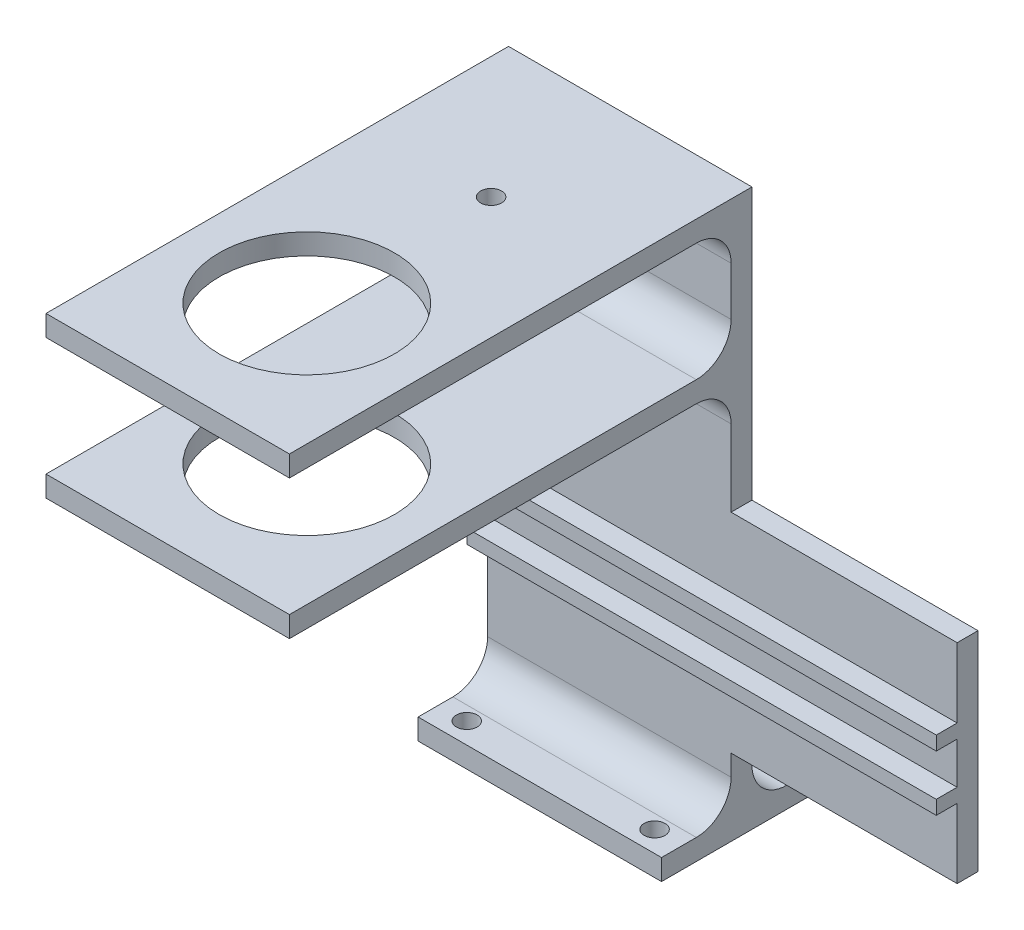
from build123d import *

# Parameters (mm, degrees)
SKETCH1_W                = 35
SKETCH1_H                = 40
BOSS_EXTRUDE1_DEPTH      = 3
SKETCH2_R                = 12.6
CUT_EXTRUDE1_DEPTH       = 27.744158241
SKETCH4_W                = 35
SKETCH4_H                = 3
BOSS_EXTRUDE2_DEPTH      = 23.5
SKETCH5_W                = 35
SKETCH5_H                = 80
BOSS_EXTRUDE3_DEPTH      = 3
SKETCH6_W                = 35
SKETCH6_H                = 63.5
SKETCH6_R                = 12.6
BOSS_EXTRUDE4_DEPTH      = 3
BOSS_EXTRUDE5_DEPTH      = 10
BOSS_EXTRUDE5_DEPTH_BACK = 13
SKETCH7_W                = 35
SKETCH7_H                = 3
FILLET1_R                = 5
SKETCH8_W                = 100
SKETCH8_H                = 30
BOSS_EXTRUDE6_DEPTH      = 3
SKETCH10_W               = 100
SKETCH10_H               = 2
BOSS_EXTRUDE8_DEPTH      = 3
SKETCH12_R               = 1.5
CUT_EXTRUDE3_DEPTH       = 108.801901653
MIRROR2_COPY_1_SKETCH_R  = 1.5
MIRROR2_COPY_1_DEPTH     = 108.801901653
CUT_EXTRUDE4_DEPTH       = 32.5
SKETCH26_R               = 1.5
CUT_EXTRUDE17_DEPTH      = 10


with BuildPart() as part:
    # Sketch1 → Boss-Extrude1 (new body)
    with BuildSketch(Plane(origin=(0, 0, 0), x_dir=(1, 0, 0), z_dir=(0, 1, 0))):
        Rectangle(SKETCH1_W, SKETCH1_H)
    extrude(amount=BOSS_EXTRUDE1_DEPTH)

    # Sketch2 → Cut-Extrude1 (cut, through all)
    with BuildSketch(Plane(origin=(0, 3, 0), x_dir=(1, 0, 0), z_dir=(0, 1, 0))):
        with Locations(Location((0, 0, 0), (0, 0, 270))):
            Circle(SKETCH2_R)
    extrude(amount=-CUT_EXTRUDE1_DEPTH, mode=Mode.SUBTRACT)

    # Sketch4 → Boss-Extrude2 (add)
    with BuildSketch(Plane(origin=(0, 0, -20), x_dir=(-1, 0, 0), z_dir=(0, 0, -1))):
        with Locations((0, 1.5)):
            Rectangle(SKETCH4_W, SKETCH4_H)
    extrude(amount=BOSS_EXTRUDE2_DEPTH)

    # Sketch5 → Boss-Extrude3 (add)
    with BuildSketch(Plane(origin=(0, 0, -43.5), x_dir=(-1, 0, 0), z_dir=(0, 0, -1))):
        with Locations((0, -37)):
            Rectangle(SKETCH5_W, SKETCH5_H)
    extrude(amount=BOSS_EXTRUDE3_DEPTH)

    # Sketch6 → Boss-Extrude4 (add)
    with BuildSketch(Plane(origin=(0, -17, 0), x_dir=(1, 0, 0), z_dir=(0, 1, 0))):
        with Locations((0, 11.75)):
            Rectangle(SKETCH6_W, SKETCH6_H)
        with Locations(Location((0, 0, 0), (0, 0, 270))):
            Circle(SKETCH6_R, mode=Mode.SUBTRACT)
    extrude(amount=-BOSS_EXTRUDE4_DEPTH)

    # Sketch7 → Boss-Extrude5 (add, two sides: drawn at the far end of the back side and taken through both)
    with BuildSketch(Plane.XY.offset(-43.5).offset(-BOSS_EXTRUDE5_DEPTH_BACK)):
        with Locations((0, -75.5)):
            Rectangle(SKETCH7_W, SKETCH7_H)
    extrude(amount=BOSS_EXTRUDE5_DEPTH + BOSS_EXTRUDE5_DEPTH_BACK)

    # Fillet1
    fillet1_edges = [part.edges().sort_by_distance(p)[0] for p in [
        (0, 0, -43.5),
        (0, -20, -43.5),
        (0, -17, -43.5),
        (0, -74, -46.5),
        (0, -74, -43.5),
    ]]
    fillet(fillet1_edges, radius=FILLET1_R)

    # Sketch8 → Boss-Extrude6 (add)
    with BuildSketch(Plane.XY.offset(-43.5)):
        with Locations((0, -51)):
            Rectangle(SKETCH8_W, SKETCH8_H)
    extrude(amount=-BOSS_EXTRUDE6_DEPTH)

    # Sketch10 → Boss-Extrude8 (add)
    with BuildSketch(Plane.XY.offset(-43.5)):
        with Locations((0, -47)):
            Rectangle(SKETCH10_W, SKETCH10_H)
        with Locations((0, -55)):
            Rectangle(SKETCH10_W, SKETCH10_H)
    extrude(amount=BOSS_EXTRUDE8_DEPTH)

    # Sketch12 → Cut-Extrude3 (cut, through all)
    with BuildSketch(Plane(origin=(0, -74, 0), x_dir=(1, 0, 0), z_dir=(0, 1, 0))):
        with Locations(Location((-13.5, 36.5, 0), (0, 0, 270))):
            Circle(SKETCH12_R)
    cut_extrude3 = extrude(amount=-CUT_EXTRUDE3_DEPTH, mode=Mode.SUBTRACT)

    # Mirror1: Cut-Extrude3 across plane
    add(cut_extrude3.mirror(Plane.ZY), mode=Mode.SUBTRACT)

    # Mirror2: Cut-Extrude3 across plane
    add(cut_extrude3.mirror(Plane(origin=(0, 0, -45), x_dir=(1, 0, 0), z_dir=(0, 0, -1))), mode=Mode.SUBTRACT)

    # Mirror2 copy 1 sketch → Mirror2 copy 1 (cut, through all)
    with BuildSketch(Plane(origin=(0, -74, -90), x_dir=(-1, 0, 0), z_dir=(0, 1, 0))):
        with Locations(Location((-13.5, 36.5, 0), (0, 0, 270))):
            Circle(MIRROR2_COPY_1_SKETCH_R)
    extrude(amount=-MIRROR2_COPY_1_DEPTH, mode=Mode.SUBTRACT)

    # Sketch13 → Cut-Extrude4 (cut)
    with BuildSketch(Plane.ZY.offset(50)):
        Polygon((-43.5, -36), (-46.5, -36), (-46.5, -66), (-43.5, -66), (-43.5, -56), (-40.5, -56), (-40.5, -54), (-43.5, -54), (-43.5, -48), (-40.5, -48), (-40.5, -46), (-43.5, -46), align=None)
    extrude(amount=-CUT_EXTRUDE4_DEPTH, mode=Mode.SUBTRACT)

    # Sketch26 → Cut-Extrude17 (cut)
    with BuildSketch(Plane(origin=(0, 3, 0), x_dir=(1, 0, 0), z_dir=(0, 1, 0))):
        with Locations(Location((0, 26.5, 0), (0, 0, 270))):
            Circle(SKETCH26_R)
    extrude(amount=-CUT_EXTRUDE17_DEPTH, mode=Mode.SUBTRACT)


solid = part.part
